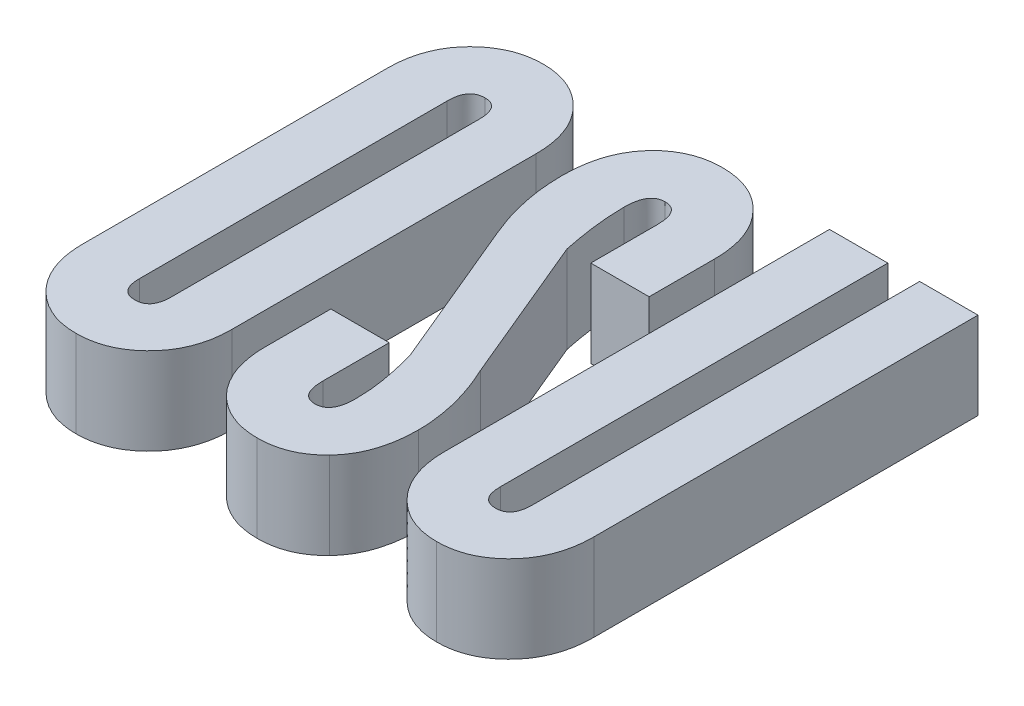
from build123d import *

# Parameters (mm, degrees)
BOSS_EXTRUDE1_DEPTH   = 3.302
BOSS_EXTRUDE1_2_DEPTH = 3.302
BOSS_EXTRUDE1_3_DEPTH = 3.302


with BuildPart() as part:
    # Sketch1 → Boss-Extrude1 (new body)
    with BuildSketch(Plane(origin=(0, 0, 0), x_dir=(1, 0, 0), z_dir=(0, 1, 0))):
        with BuildLine():
            add(Edge.make_bspline(
                [(-8.12874289, -0.571983961), (-8.131068574, -0.684256655), (-8.135603426, -0.903177262), (-8.173722024, -1.224423083), (-8.239406062, -1.528644179), (-8.331072914, -1.817202588), (-8.447729638, -2.089158402), (-8.590140651, -2.345058371), (-8.75731443, -2.586569247), (-8.951996938, -2.806246773), (-9.160683876, -3.008430805), (-9.385881417, -3.180841679), (-9.618901521, -3.331597779), (-9.866007755, -3.449817842), (-10.122106089, -3.546763912), (-10.39066861, -3.61066945), (-10.669462474, -3.654414417), (-10.859417669, -3.65832152), (-10.956038297, -3.660308866)],
                knots=[0, 0, 0, 0, 1.150870775, 2.244083756, 3.310821464, 4.337382004, 5.343654245, 6.339598371, 7.335484497, 8.348621665, 9.344507791, 10.309821871, 11.252061722, 12.184627206, 13.11303345, 14.054107807, 15.01022277, 16, 16, 16, 16], degree=3))
            add(Edge.make_bspline(
                [(-10.956038297, -3.660308866), (-11.052657175, -3.658318106), (-11.242608928, -3.65440429), (-11.521427803, -3.610708099), (-11.789897823, -3.546622168), (-12.045453584, -3.450672003), (-12.290491002, -3.330501456), (-12.522878842, -3.181999509), (-12.745136889, -3.007155491), (-12.95384868, -2.807306672), (-13.145547191, -2.586453764), (-13.308781135, -2.344051765), (-13.452773788, -2.09004685), (-13.564100728, -1.816307424), (-13.658229996, -1.529200994), (-13.718305576, -1.223934718), (-13.757926934, -0.903250451), (-13.762248038, -0.684281466), (-13.764464102, -0.571983961)],
                knots=[0, 0, 0, 0, 0.992114445, 1.950487135, 2.893783703, 3.824382242, 4.749476454, 5.693941267, 6.653040364, 7.651278131, 8.659753907, 9.651868352, 10.650164255, 11.654603576, 12.683588189, 13.750617167, 14.846411611, 16, 16, 16, 16], degree=3))
            Line((-13.764464102, -0.571983961), (-13.764464102, 10.963632895))
            add(Edge.make_bspline(
                [(-13.764464102, 10.963632895), (-13.762144663, 11.075908002), (-13.757621987, 11.294833315), (-13.71941627, 11.616045467), (-13.654048031, 11.920388613), (-13.561382433, 12.208122103), (-13.448997195, 12.481288271), (-13.307559049, 12.737460783), (-13.134232394, 12.973229039), (-12.944892242, 13.196104751), (-12.73528543, 13.396508892), (-12.510282811, 13.570712274), (-12.273885013, 13.718456502), (-12.028174494, 13.842352019), (-11.770954618, 13.938128689), (-11.50257827, 14.002395864), (-11.223734068, 14.04604305), (-11.0337858, 14.04996361), (-10.937168695, 14.0519578)],
                knots=[0, 0, 0, 0, 1.150866748, 2.244075904, 3.31080988, 4.337366828, 5.339436392, 6.335377033, 7.328704338, 8.334800835, 9.330683476, 10.29599418, 11.247321121, 12.184640556, 13.113043551, 14.054114615, 15.010226234, 16, 16, 16, 16], degree=3))
            add(Edge.make_bspline(
                [(-10.937168695, 14.0519578), (-10.840552797, 14.049961092), (-10.650606901, 14.046035583), (-10.37174546, 14.002424364), (-10.10343287, 13.938024168), (-9.846858472, 13.843064118), (-9.60359102, 13.718304183), (-9.370188225, 13.570770879), (-9.148142803, 13.395561295), (-8.939207635, 13.195927424), (-8.74875373, 12.975246147), (-8.583436439, 12.735336263), (-8.44058588, 12.481590504), (-8.329064186, 12.207985374), (-8.23498884, 11.920841761), (-8.174898119, 11.615585926), (-8.135280943, 11.294898774), (-8.130959254, 11.075930193), (-8.12874289, 10.963632895)],
                knots=[0, 0, 0, 0, 0.992365929, 1.95098155, 2.894517228, 3.825351658, 4.755499656, 5.700203875, 6.659546088, 7.65803689, 8.666768299, 9.650259208, 10.648808162, 11.653502091, 12.682747534, 13.750046986, 14.846119196, 16, 16, 16, 16], degree=3))
            Line((-8.12874289, 10.963632895), (-8.12874289, -0.571983961))
        make_face()
        with BuildLine():
            Line((-10.342776223, -0.650607304), (-10.342776223, 11.020241702))
            add(Edge.make_bspline(
                [(-10.342776223, 11.020241702), (-10.344426914, 11.084264067), (-10.347530587, 11.204640622), (-10.374153695, 11.372625016), (-10.423116969, 11.513733582), (-10.482889686, 11.634976585), (-10.572725429, 11.723956222), (-10.675499625, 11.794798161), (-10.801791497, 11.831060914), (-10.890863166, 11.835576801), (-10.937168695, 11.837924467)],
                knots=[0, 0, 0, 0, 1.336635857, 2.513178339, 3.530565084, 4.451062573, 5.302353795, 6.140032556, 7.033062066, 8, 8, 8, 8], degree=3))
            add(Edge.make_bspline(
                [(-10.937168695, 11.837924467), (-10.985677033, 11.83588249), (-11.077053043, 11.832035982), (-11.205968564, 11.792999741), (-11.313937415, 11.726391913), (-11.402964406, 11.633029983), (-11.471678407, 11.515864171), (-11.5184318, 11.3722537), (-11.545867292, 11.204754667), (-11.548846353, 11.084303663), (-11.550430769, 11.020241702)],
                knots=[0, 0, 0, 0, 0.997799626, 1.879572745, 2.743151987, 3.583712918, 4.513936717, 5.518499582, 6.68021207, 8, 8, 8, 8], degree=3))
            Line((-11.550430769, 11.020241702), (-11.550430769, -0.650607304))
            add(Edge.make_bspline(
                [(-11.550430769, -0.650607304), (-11.54879729, -0.712571174), (-11.545704616, -0.829887694), (-11.518480775, -0.993253828), (-11.471667759, -1.133808472), (-11.402904915, -1.247871166), (-11.31372981, -1.338257499), (-11.205069385, -1.400815469), (-11.077162766, -1.440590233), (-10.985715082, -1.444304016), (-10.937168695, -1.446275533)],
                knots=[0, 0, 0, 0, 1.297706526, 2.456954578, 3.457341835, 4.384115695, 5.222885016, 6.089385025, 6.985721137, 8, 8, 8, 8], degree=3))
            add(Edge.make_bspline(
                [(-10.937168695, -1.446275533), (-10.890823879, -1.443994695), (-10.801676638, -1.439607357), (-10.676458036, -1.402617718), (-10.572842537, -1.335851844), (-10.483008803, -1.249827279), (-10.423079999, -1.131650118), (-10.374113986, -0.993629192), (-10.347687377, -0.829774268), (-10.344473643, -0.712531971), (-10.342776223, -0.650607304)],
                knots=[0, 0, 0, 0, 0.983233978, 1.891313936, 2.731106387, 3.58086531, 4.497359879, 5.510854266, 6.685290851, 8, 8, 8, 8], degree=3))
        make_face(mode=Mode.SUBTRACT)
    extrude(amount=BOSS_EXTRUDE1_DEPTH)


with BuildPart() as body_2:
    # Sketch1 → Boss-Extrude1 2 (new body)
    with BuildSketch(Plane(origin=(0, 0, 0), x_dir=(1, 0, 0), z_dir=(0, 1, 0))):
        with BuildLine():
            Line((-1.285367132, 8.416236588), (-3.499400466, 8.416236588))
            Line((-3.499400466, 8.416236588), (-3.499400466, 10.932183558))
            add(Edge.make_bspline(
                [(-3.499400466, 10.932183558), (-3.500851688, 11.003600768), (-3.503554314, 11.136601758), (-3.532249429, 11.322434625), (-3.576613092, 11.480825972), (-3.644577653, 11.610883654), (-3.728927476, 11.715801729), (-3.838657538, 11.786152096), (-3.964232095, 11.833522385), (-4.055580788, 11.836415457), (-4.103227739, 11.837924467)],
                knots=[0, 0, 0, 0, 1.388101938, 2.585076231, 3.649644369, 4.570966944, 5.424816129, 6.233641139, 7.078677425, 8, 8, 8, 8], degree=3))
            add(Edge.make_bspline(
                [(-4.103227739, 11.837924467), (-4.150752828, 11.834949209), (-4.241772098, 11.829251043), (-4.369940709, 11.784198781), (-4.476471423, 11.705358366), (-4.563984126, 11.597306859), (-4.628632903, 11.458935008), (-4.675179264, 11.292225524), (-4.702439918, 11.096603343), (-4.705453441, 10.956385141), (-4.707055011, 10.881864619)],
                knots=[0, 0, 0, 0, 0.89250042, 1.709302145, 2.513640202, 3.354122243, 4.297420952, 5.364241039, 6.599196598, 8, 8, 8, 8], degree=3))
            add(Edge.make_bspline(
                [(-4.707055011, 10.881864619), (-4.702891437, 10.700393012), (-4.694211509, 10.322073689), (-4.637122865, 9.731107169), (-4.546875313, 9.093895888), (-4.459751778, 8.655918104), (-4.414576176, 8.428816323)],
                knots=[0, 0, 0, 0, 0.880068233, 1.834704745, 2.87724349, 4, 4, 4, 4], degree=3))
            Line((-4.414576176, 8.428816323), (-2.068455627, 2.802529912))
            add(Edge.make_bspline(
                [(-2.068455627, 2.802529912), (-2.006569332, 2.6656739), (-1.884762181, 2.39630827), (-1.72326148, 1.989828608), (-1.588926021, 1.588494716), (-1.476667281, 1.192197094), (-1.392404686, 0.801292444), (-1.332946243, 0.41476872), (-1.292682337, 0.034788174), (-1.287788409, -0.217556151), (-1.285367132, -0.3424038)],
                knots=[0, 0, 0, 0, 1.103280862, 2.171522759, 3.211379636, 4.211021544, 5.195840725, 6.146682417, 7.083068966, 8, 8, 8, 8], degree=3))
            add(Edge.make_bspline(
                [(-1.285367132, -0.3424038), (-1.28748271, -0.473537563), (-1.291606449, -0.729146858), (-1.332207701, -1.100800196), (-1.403288415, -1.448055161), (-1.491928974, -1.776201237), (-1.615601543, -2.079973841), (-1.76285462, -2.362816689), (-1.941034095, -2.620272485), (-2.078369054, -2.774766272), (-2.14707897, -2.852060902)],
                knots=[0, 0, 0, 0, 1.156361606, 2.25400971, 3.291229419, 4.280611747, 5.247266713, 6.177873313, 7.088373634, 8, 8, 8, 8], degree=3))
            add(Edge.make_bspline(
                [(-2.14707897, -2.852060902), (-2.211641982, -2.916651102), (-2.339731836, -3.044794894), (-2.556200137, -3.205644536), (-2.778606063, -3.350532974), (-3.017189697, -3.463409575), (-3.265975122, -3.551588701), (-3.527207235, -3.615083199), (-3.800179183, -3.653211819), (-3.986743426, -3.657923189), (-4.081213203, -3.660308866)],
                knots=[0, 0, 0, 0, 1.014595917, 2.012908598, 2.993212371, 3.963405696, 4.940861257, 5.925180132, 6.949381904, 8, 8, 8, 8], degree=3))
            add(Edge.make_bspline(
                [(-4.081213203, -3.660308866), (-4.174672047, -3.658073176), (-4.3592224, -3.653658426), (-4.630332608, -3.613124197), (-4.893006767, -3.556649691), (-5.142920842, -3.464513042), (-5.385682793, -3.356673633), (-5.616276915, -3.220043242), (-5.835648743, -3.057766929), (-5.971323785, -2.934027462), (-6.040506905, -2.870930505)],
                knots=[0, 0, 0, 0, 1.034024809, 2.041857499, 3.03011876, 4.002924071, 4.984620557, 5.967962345, 6.963827817, 8, 8, 8, 8], degree=3))
            add(Edge.make_bspline(
                [(-6.040506905, -2.870930505), (-6.111861431, -2.795116183), (-6.253488182, -2.644637485), (-6.427868914, -2.387204809), (-6.584496739, -2.119239943), (-6.70581778, -1.828603453), (-6.806237541, -1.523317377), (-6.867526837, -1.197456955), (-6.916492745, -0.856488719), (-6.919532996, -0.622500434), (-6.921088345, -0.502795419)],
                knots=[0, 0, 0, 0, 0.961843818, 1.909098464, 2.869228767, 3.829604045, 4.817413096, 5.837095117, 6.893489218, 8, 8, 8, 8], degree=3))
            Line((-6.921088345, -0.502795419), (-6.921088345, 1.975412346))
            Line((-6.921088345, 1.975412346), (-4.707055011, 1.975412346))
            Line((-4.707055011, 1.975412346), (-4.707055011, -0.540534624))
            add(Edge.make_bspline(
                [(-4.707055011, -0.540534624), (-4.705400417, -0.610854669), (-4.702273412, -0.743751951), (-4.675456815, -0.929127413), (-4.627996131, -1.087158964), (-4.564153002, -1.218931152), (-4.475198443, -1.320280053), (-4.369695898, -1.396171921), (-4.241149594, -1.436736474), (-4.150656825, -1.442995206), (-4.103227739, -1.446275533)],
                knots=[0, 0, 0, 0, 1.369486159, 2.588180739, 3.63457484, 4.575208708, 5.414651828, 6.236018696, 7.075461816, 8, 8, 8, 8], degree=3))
            add(Edge.make_bspline(
                [(-4.103227739, -1.446275533), (-4.055702649, -1.443300275), (-3.964683379, -1.437602109), (-3.836514768, -1.392549847), (-3.729984054, -1.313709432), (-3.642471351, -1.205657925), (-3.577822574, -1.067286074), (-3.531276213, -0.90057659), (-3.504015559, -0.704954409), (-3.501002036, -0.564736207), (-3.499400466, -0.490215685)],
                knots=[0, 0, 0, 0, 0.89250042, 1.709302145, 2.513640202, 3.354122243, 4.297420952, 5.364241039, 6.599196598, 8, 8, 8, 8], degree=3))
            add(Edge.make_bspline(
                [(-3.499400466, -0.490215685), (-3.504353051, -0.30126283), (-3.514627733, 0.090740667), (-3.599957614, 0.698039935), (-3.73031043, 1.345624524), (-3.85582076, 1.785396873), (-3.920821583, 2.01315155)],
                knots=[0, 0, 0, 0, 0.889898999, 1.846193441, 2.884560347, 4, 4, 4, 4], degree=3))
            Line((-3.920821583, 2.01315155), (-6.270087066, 7.648872762))
            add(Edge.make_bspline(
                [(-6.270087066, 7.648872762), (-6.371207449, 7.904866702), (-6.570324329, 8.408946223), (-6.766772333, 9.188715224), (-6.897626281, 9.965395635), (-6.91329643, 10.485077801), (-6.921088345, 10.743487535)],
                knots=[0, 0, 0, 0, 1.036832852, 2.041635085, 3.02621142, 4, 4, 4, 4], degree=3))
            add(Edge.make_bspline(
                [(-6.921088345, 10.743487535), (-6.919147866, 10.874651539), (-6.915380856, 11.129277366), (-6.87265935, 11.49928526), (-6.807627259, 11.847806744), (-6.715287457, 12.174220374), (-6.589903592, 12.476551853), (-6.442134375, 12.75690101), (-6.270818947, 13.018530671), (-6.13174159, 13.170979506), (-6.062521441, 13.24685477)],
                knots=[0, 0, 0, 0, 1.159440677, 2.250796961, 3.289000151, 4.292473762, 5.244524641, 6.177609189, 7.09297842, 8, 8, 8, 8], degree=3))
            add(Edge.make_bspline(
                [(-6.062521441, 13.24685477), (-5.997782776, 13.311203835), (-5.869933918, 13.438283295), (-5.657239082, 13.60192445), (-5.433056737, 13.7415836), (-5.196480805, 13.854486508), (-4.94814754, 13.944400837), (-4.687445574, 14.00583573), (-4.414722624, 14.045175779), (-4.229163793, 14.049669562), (-4.134677076, 14.0519578)],
                knots=[0, 0, 0, 0, 1.017984989, 2.010363043, 2.987727369, 3.961161447, 4.930861155, 5.929839552, 6.945872507, 8, 8, 8, 8], degree=3))
            add(Edge.make_bspline(
                [(-4.134677076, 14.0519578), (-4.040175802, 14.049702201), (-3.853549356, 14.045247716), (-3.580257002, 14.005140594), (-3.316636187, 13.94817489), (-3.06743516, 13.856837417), (-2.826995773, 13.748234259), (-2.599631242, 13.611547162), (-2.383596722, 13.450201703), (-2.251785586, 13.32578836), (-2.184818174, 13.262579439)],
                knots=[0, 0, 0, 0, 1.048774086, 2.071178214, 3.062420754, 4.038160717, 5.012232511, 5.988527898, 6.978059923, 8, 8, 8, 8], degree=3))
            add(Edge.make_bspline(
                [(-2.184818174, 13.262579439), (-2.112778127, 13.186549611), (-1.96942828, 13.035260645), (-1.786740977, 12.78108436), (-1.63335045, 12.509032722), (-1.50171366, 12.222043927), (-1.404938343, 11.914278838), (-1.337659461, 11.589628906), (-1.290310434, 11.24805454), (-1.287040158, 11.014121239), (-1.285367132, 10.894444353)],
                knots=[0, 0, 0, 0, 0.965006751, 1.920231542, 2.877069188, 3.841930668, 4.826352141, 5.844512552, 6.89728387, 8, 8, 8, 8], degree=3))
            Line((-1.285367132, 10.894444353), (-1.285367132, 8.416236588))
        make_face()
    extrude(amount=BOSS_EXTRUDE1_2_DEPTH)


with BuildPart() as body_3:
    # Sketch1 → Boss-Extrude1 3 (new body)
    with BuildSketch(Plane(origin=(0, 0, 0), x_dir=(1, 0, 0), z_dir=(0, 1, 0))):
        with BuildLine():
            add(Edge.make_bspline(
                [(5.558008625, -0.521665022), (5.555577058, -0.634974532), (5.550790061, -0.85804559), (5.513615822, -1.184624776), (5.44741691, -1.494056528), (5.354960612, -1.786434487), (5.239885916, -2.063243786), (5.096552402, -2.322929458), (4.929547682, -2.567637493), (4.734797627, -2.790444322), (4.526131789, -2.995716379), (4.300972536, -3.17139491), (4.067875271, -3.324921778), (3.821593493, -3.447531028), (3.564040773, -3.542440986), (3.296637784, -3.611770863), (3.017210437, -3.654115721), (2.827307345, -3.658220813), (2.730713218, -3.660308866)],
                knots=[0, 0, 0, 0, 1.151754111, 2.267444333, 3.335547789, 4.363555893, 5.38090272, 6.377724591, 7.373919619, 8.386510763, 9.381336764, 10.345022318, 11.285022955, 12.214391478, 13.134919195, 14.070620796, 15.018622095, 16, 16, 16, 16], degree=3))
            add(Edge.make_bspline(
                [(2.730713218, -3.660308866), (2.634120907, -3.658217347), (2.444221384, -3.654105442), (2.164768073, -3.611810139), (1.897461283, -3.542296663), (1.640435837, -3.448384569), (1.396256029, -3.323812972), (1.163749153, -3.172559303), (0.941571893, -2.994436689), (0.732842828, -2.791504804), (0.541098427, -2.567518332), (0.37803594, -2.321931776), (0.233107737, -2.064116152), (0.123373762, -1.785556919), (0.028452468, -1.494605298), (-0.032112759, -1.184135782), (-0.070819525, -0.858118379), (-0.075390665, -0.634999051), (-0.077712587, -0.521665022)],
                knots=[0, 0, 0, 0, 0.983655955, 1.933857829, 2.871731453, 3.79439597, 4.716380079, 5.658562719, 6.616121104, 7.613256372, 8.621260386, 9.613750455, 10.612886225, 11.62850218, 12.658896576, 13.7272923, 14.845572348, 16, 16, 16, 16], degree=3))
            Line((-0.077712587, -0.521665022), (-0.077712587, 14.0519578))
            Line((-0.077712587, 14.0519578), (2.136320746, 14.0519578))
            Line((2.136320746, 14.0519578), (2.136320746, -0.638027569))
            add(Edge.make_bspline(
                [(2.136320746, -0.638027569), (2.13779815, -0.701082681), (2.140573385, -0.819528827), (2.169587067, -0.985410116), (2.213328962, -1.129321206), (2.285030424, -1.244675478), (2.371795835, -1.338413108), (2.481840618, -1.400667723), (2.609542356, -1.440633483), (2.701020345, -1.444319013), (2.74958282, -1.446275533)],
                knots=[0, 0, 0, 0, 1.306709686, 2.45459439, 3.486350212, 4.404039517, 5.250107251, 6.108113529, 6.995663447, 8, 8, 8, 8], degree=3))
            add(Edge.make_bspline(
                [(2.74958282, -1.446275533), (2.795942949, -1.444009049), (2.885119645, -1.43964932), (3.01013533, -1.402469476), (3.115094254, -1.335961007), (3.202599654, -1.246661768), (3.26532492, -1.127104833), (3.311326876, -0.985789454), (3.339535211, -0.819413754), (3.342432769, -0.701042704), (3.343975292, -0.638027569)],
                knots=[0, 0, 0, 0, 0.973470957, 1.872534136, 2.703987869, 3.561030759, 4.468424996, 5.513564712, 6.67633973, 8, 8, 8, 8], degree=3))
            Line((3.343975292, -0.638027569), (3.343975292, 14.0519578))
            Line((3.343975292, 14.0519578), (5.558008625, 14.0519578))
            Line((5.558008625, 14.0519578), (5.558008625, -0.521665022))
        make_face()
    extrude(amount=BOSS_EXTRUDE1_3_DEPTH)


solid = Compound([part.part, body_2.part, body_3.part])
